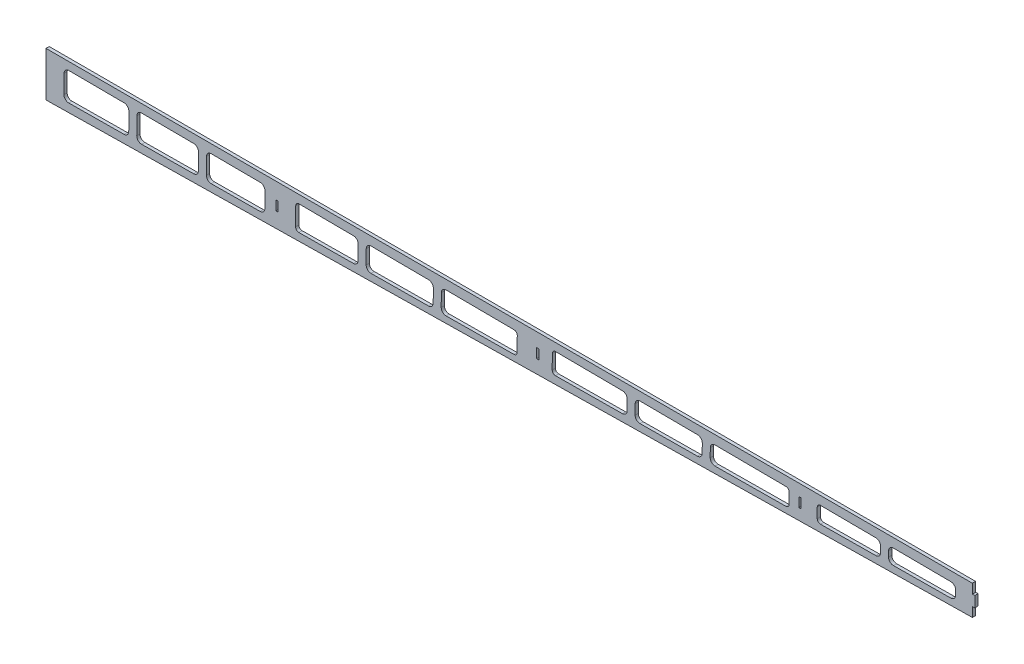
from build123d import *

# Parameters (mm, degrees)
MODEL_W         = 1.5
MODEL_H         = 6
EXTRUDE_1_DEPTH = 2


with BuildPart() as part:
    # Model → 凸台-拉伸1 (new body)
    with BuildSketch(Plane.XY):
        Polygon((785.435098254, -35.533863858), (785.435098254, -41.446863858), (786.935098254, -41.446863858), (786.935098254, -48.147363858), (785.435098254, -48.147363858), (785.466503891, -54.069864101), (206.600074702, -63.475463858), (206.600074702, -35.533863858), (351.503693607, -35.533863858), (514.281059293, -35.533863858), (677.839139625, -35.533863858), align=None)
        with Locations((350.950492985, -48.643663858)):
            Rectangle(MODEL_W, MODEL_H, mode=Mode.SUBTRACT)
        with Locations((513.951245542, -47.152263858)):
            Rectangle(MODEL_W, MODEL_H, mode=Mode.SUBTRACT)
        with Locations((677.733784151, -45.843763858)):
            Rectangle(MODEL_W, MODEL_H, mode=Mode.SUBTRACT)
        with BuildLine():
            Line((255.385635934, -40.600624691), (220.886272881, -40.391624977))
            ThreePointArc((220.886272881, -40.391624977), (218.759668454, -41.257437629), (217.86815404, -43.373396038))
            Line((217.86815404, -43.373396038), (217.797915248, -54.967639695))
            ThreePointArc((217.797915248, -54.967639695), (218.679987229, -57.11057571), (220.825776537, -57.985683696))
            Line((220.825776537, -57.985683696), (255.328350826, -57.664607948))
            ThreePointArc((255.328350826, -57.664607948), (257.425196612, -56.782610808), (258.300379439, -54.682911728))
            Line((258.300379439, -54.682911728), (258.367406995, -43.618743532))
            ThreePointArc((258.367406995, -43.618743532), (257.501594343, -41.492139105), (255.385635934, -40.600624691))
        make_face(mode=Mode.SUBTRACT)
        with BuildLine():
            Line((343.376561044, -44.133735324), (343.317446229, -53.891755741))
            ThreePointArc((343.317446229, -53.891755741), (342.442263402, -55.99145482), (340.345417617, -56.873451961))
            Line((340.345417617, -56.873451961), (309.831033894, -57.157414209))
            ThreePointArc((309.831033894, -57.157414209), (307.685244586, -56.282306223), (306.803172604, -54.139370208))
            Line((306.803172604, -54.139370208), (306.865127466, -43.912546338))
            ThreePointArc((306.865127466, -43.912546338), (307.75664188, -41.796587929), (309.883246307, -40.930775277))
            Line((309.883246307, -40.930775277), (340.394789984, -41.115616483))
            ThreePointArc((340.394789984, -41.115616483), (342.510748392, -42.007130897), (343.376561044, -44.133735324))
        make_face(mode=Mode.SUBTRACT)
        with BuildLine():
            Line((266.384844011, -40.667258713), (298.884247648, -40.864142523))
            ThreePointArc((298.884247648, -40.864142523), (301.000206057, -41.755656937), (301.866018709, -43.882261364))
            Line((301.866018709, -43.882261364), (301.803040049, -54.278082537))
            ThreePointArc((301.803040049, -54.278082537), (300.927857222, -56.377781616), (298.831011437, -57.259778757))
            Line((298.831011437, -57.259778757), (266.328582721, -57.562241451))
            ThreePointArc((266.328582721, -57.562241451), (264.182793413, -56.687133465), (263.300721432, -54.544197451))
            Line((263.300721432, -54.544197451), (263.36672517, -43.649029774))
            ThreePointArc((263.36672517, -43.649029774), (264.258239584, -41.533071365), (266.384844011, -40.667258713))
        make_face(mode=Mode.SUBTRACT)
        with BuildLine():
            Line((364.652046592, -40.643787214), (398.722200855, -40.881122213))
            ThreePointArc((398.722200855, -40.881122213), (400.837348938, -41.774557453), (401.701230373, -43.901947122))
            Line((401.701230373, -43.901947122), (401.638680431, -52.881179864))
            ThreePointArc((401.638680431, -52.881179864), (400.762583047, -54.979090054), (398.666752779, -55.860151503))
            Line((398.666752779, -55.860151503), (364.576429773, -56.178336732))
            ThreePointArc((364.576429773, -56.178336732), (363.145224808, -55.594310395), (362.557811922, -54.164492045))
            Line((362.557811922, -54.164492045), (362.638163319, -42.629806893))
            ThreePointArc((362.638163319, -42.629806893), (363.233786812, -41.219708171), (364.652046592, -40.643787214))
        make_face(mode=Mode.SUBTRACT)
        with BuildLine():
            Line((409.711176711, -40.957672161), (445.623178301, -41.207837593))
            ThreePointArc((445.623178301, -41.207837593), (447.738326383, -42.101272833), (448.602207819, -44.228662502))
            Line((448.602207819, -44.228662502), (448.544983573, -52.443375482))
            ThreePointArc((448.544983573, -52.443375482), (447.668886189, -54.541285672), (445.573055921, -55.422347121))
            Line((445.573055921, -55.422347121), (409.66496734, -55.757498635))
            ThreePointArc((409.66496734, -55.757498635), (407.519124281, -54.882420802), (406.637022827, -52.739455411))
            Line((406.637022827, -52.739455411), (406.690334064, -43.939425485))
            ThreePointArc((406.690334064, -43.939425485), (407.582817543, -41.822510116), (409.711176711, -40.957672161))
        make_face(mode=Mode.SUBTRACT)
        with BuildLine():
            Line((456.612848306, -41.284392377), (499.068785272, -41.580143304))
            ThreePointArc((499.068785272, -41.580143304), (500.478883993, -42.175766798), (501.05480495, -43.594026577))
            Line((501.05480495, -43.594026577), (500.989716833, -52.937621934))
            ThreePointArc((500.989716833, -52.937621934), (500.40565191, -54.336228727), (499.008431732, -54.923603027))
            Line((499.008431732, -54.923603027), (456.571270482, -55.319694254))
            ThreePointArc((456.571270482, -55.319694254), (454.425427423, -54.44461642), (453.543325968, -52.301651029))
            Line((453.543325968, -52.301651029), (453.592005659, -44.2661457))
            ThreePointArc((453.592005659, -44.2661457), (454.484489138, -42.149230332), (456.612848306, -41.284392377))
        make_face(mode=Mode.SUBTRACT)
        with BuildLine():
            Line((524.966262719, -40.425528272), (566.772351734, -40.716752315))
            ThreePointArc((566.772351734, -40.716752315), (568.886543297, -41.609218056), (569.751398989, -43.734853418))
            Line((569.751398989, -43.734853418), (569.712675089, -50.118674115))
            ThreePointArc((569.712675089, -50.118674115), (568.843585982, -52.229548043), (566.740674761, -53.117731028))
            Line((566.740674761, -53.117731028), (524.907725967, -53.508182781))
            ThreePointArc((524.907725967, -53.508182781), (523.476521002, -52.924156445), (522.889108116, -51.494338094))
            Line((522.889108116, -51.494338094), (522.952379447, -42.41154795))
            ThreePointArc((522.952379447, -42.41154795), (523.54800294, -41.001449229), (524.966262719, -40.425528272))
        make_face(mode=Mode.SUBTRACT)
        with BuildLine():
            Line((577.772161323, -40.793377732), (613.674023329, -41.04347253))
            ThreePointArc((613.674023329, -41.04347253), (615.788214892, -41.935938271), (616.653070584, -44.061573634))
            Line((616.653070584, -44.061573634), (616.618923292, -49.698231202))
            ThreePointArc((616.618923292, -49.698231202), (615.743769843, -51.797900808), (613.646977903, -52.679926646))
            Line((613.646977903, -52.679926646), (577.741570583, -53.015053135))
            ThreePointArc((577.741570583, -53.015053135), (575.595727525, -52.139975302), (574.71362607, -49.99700991))
            Line((574.71362607, -49.99700991), (574.751318676, -43.775131055))
            ThreePointArc((574.751318676, -43.775131055), (575.643802155, -41.658215687), (577.772161323, -40.793377732))
        make_face(mode=Mode.SUBTRACT)
        with BuildLine():
            Line((624.673832918, -41.120097947), (668.962768968, -41.42861767))
            ThreePointArc((668.962768968, -41.42861767), (670.372867689, -42.024241164), (670.948788646, -43.442500943))
            Line((670.948788646, -43.442500943), (670.901868396, -50.178044171))
            ThreePointArc((670.901868396, -50.178044171), (670.317803474, -51.576650964), (668.920583295, -52.164025264))
            Line((668.920583295, -52.164025264), (624.647873725, -52.577248753))
            ThreePointArc((624.647873725, -52.577248753), (622.502030667, -51.70217092), (621.619929212, -49.559205528))
            Line((621.619929212, -49.559205528), (621.652990271, -44.101851271))
            ThreePointArc((621.652990271, -44.101851271), (622.54547375, -41.984935902), (624.673832918, -41.120097947))
        make_face(mode=Mode.SUBTRACT)
        with BuildLine():
            Line((690.49539131, -40.869236621), (725.101155649, -41.110302716))
            ThreePointArc((725.101155649, -41.110302716), (727.216303731, -42.003737956), (728.080185166, -44.131127625))
            Line((728.080185166, -44.131127625), (728.054828945, -47.77108965))
            ThreePointArc((728.054828945, -47.77108965), (727.178731561, -49.86899984), (725.082901293, -50.750061289))
            Line((725.082901293, -50.750061289), (690.49539131, -51.072887059))
            ThreePointArc((690.49539131, -51.072887059), (689.068579953, -50.493230381), (688.476725528, -49.07143544))
            Line((688.476725528, -49.07143544), (688.481508037, -42.8552563))
            ThreePointArc((688.481508037, -42.8552563), (689.077131531, -41.445157578), (690.49539131, -40.869236621))
        make_face(mode=Mode.SUBTRACT)
        with BuildLine():
            Line((736.09497932, -41.186886435), (772.002133094, -41.437018096))
            ThreePointArc((772.002133094, -41.437018096), (774.117281177, -42.330453336), (774.981162612, -44.457843005))
            Line((774.981162612, -44.457843005), (774.961132087, -47.333285268))
            ThreePointArc((774.961132087, -47.333285268), (774.085034703, -49.431195458), (771.989204435, -50.312256907))
            Line((771.989204435, -50.312256907), (736.081115854, -50.647408421))
            ThreePointArc((736.081115854, -50.647408421), (733.935272795, -49.772330588), (733.053171341, -47.629365197))
            Line((733.053171341, -47.629365197), (733.074136673, -44.168639758))
            ThreePointArc((733.074136673, -44.168639758), (733.966620152, -42.051724389), (736.09497932, -41.186886435))
        make_face(mode=Mode.SUBTRACT)
    extrude(amount=EXTRUDE_1_DEPTH)


solid = part.part
